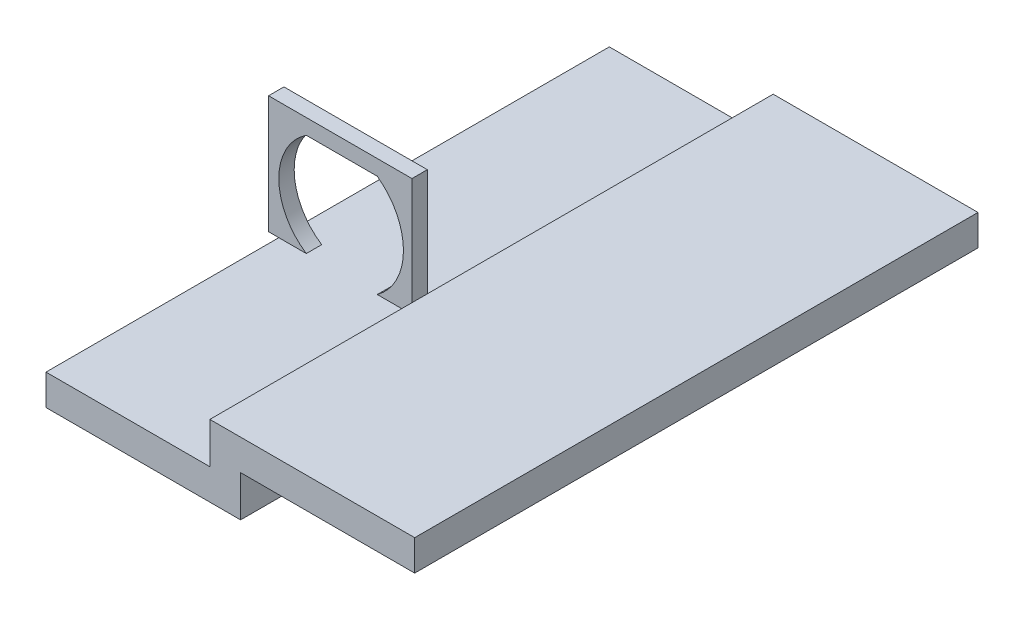
from build123d import *

# Parameters (mm, degrees)
AUFSATZ_LINEAR_AUSTRAGEN1_DEPTH = 55
SKIZZE4_W                       = 14
SKIZZE4_H                       = 1.5
AUFSATZ_LINEAR_AUSTRAGEN2_DEPTH = 11.5
SCHNITT_LINEAR_AUSTRAGEN1_DEPTH = 11.5


with BuildPart() as part:
    # Skizze1 → Aufsatz-Linear austragen1 (new body)
    with BuildSketch(Plane.XY):
        Polygon((-19, 0), (0, 0), (0, 4), (17, 4), (17, 7), (-3, 7), (-3, 3), (-19, 3), align=None)
    extrude(amount=AUFSATZ_LINEAR_AUSTRAGEN1_DEPTH)

    # Skizze4 → Aufsatz-Linear austragen2 (add)
    with BuildSketch(Plane(origin=(0, 3, 0), x_dir=(1, 0, 0), z_dir=(0, 1, 0))):
        with Locations((-13, -31.517965139)):
            Rectangle(SKIZZE4_W, SKIZZE4_H)
    extrude(amount=AUFSATZ_LINEAR_AUSTRAGEN2_DEPTH)

    # Skizze7 → Schnitt-Linear austragen1 (cut)
    with BuildSketch(Plane.XY.offset(32.267965139)):
        with BuildLine():
            Line((-9.38702331, 3), (-16.31662479, 3))
            ThreePointArc((-16.31662479, 3), (-19, 8), (-16.31662479, 13))
            Line((-16.31662479, 13), (-9.38702331, 13))
            ThreePointArc((-9.38702331, 13), (-6.831239949, 8), (-9.38702331, 3))
        make_face()
    extrude(amount=-SCHNITT_LINEAR_AUSTRAGEN1_DEPTH, mode=Mode.SUBTRACT)


solid = part.part
